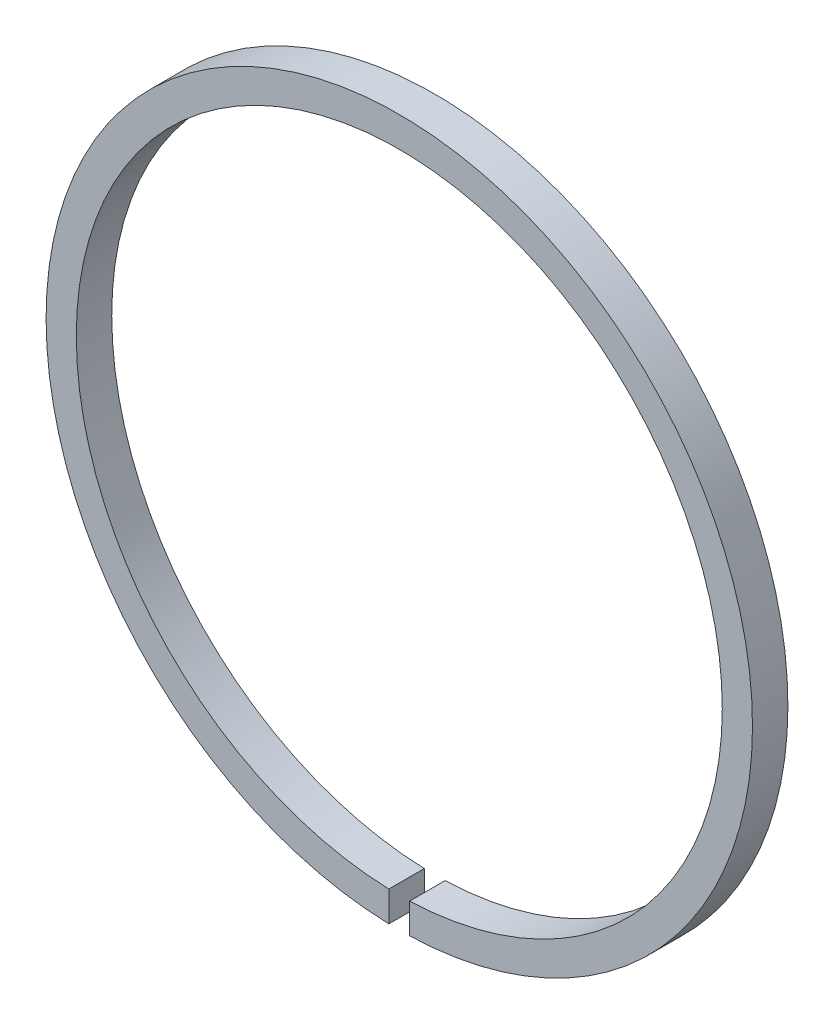
from build123d import *

# Parameters (mm, degrees)
SKETCH1_R           = 43.053
SKETCH1_R_2         = 39.37
BOSS_EXTRUDE1_DEPTH = 4.318
SKETCH2_W           = 2.54
SKETCH2_H           = 4.749764311
CUT_EXTRUDE1_DEPTH  = 62.039059151


with BuildPart() as part:
    # Sketch1 → Boss-Extrude1 (new body)
    with BuildSketch(Plane.XY):
        Circle(SKETCH1_R)
        Circle(SKETCH1_R_2, mode=Mode.SUBTRACT)
    extrude(amount=BOSS_EXTRUDE1_DEPTH)

    # Sketch2 → Cut-Extrude1 (cut, through all)
    with BuildSketch(Plane.XY):
        with Locations((0, -41.724392952)):
            Rectangle(SKETCH2_W, SKETCH2_H)
    extrude(amount=CUT_EXTRUDE1_DEPTH, mode=Mode.SUBTRACT)


solid = part.part
